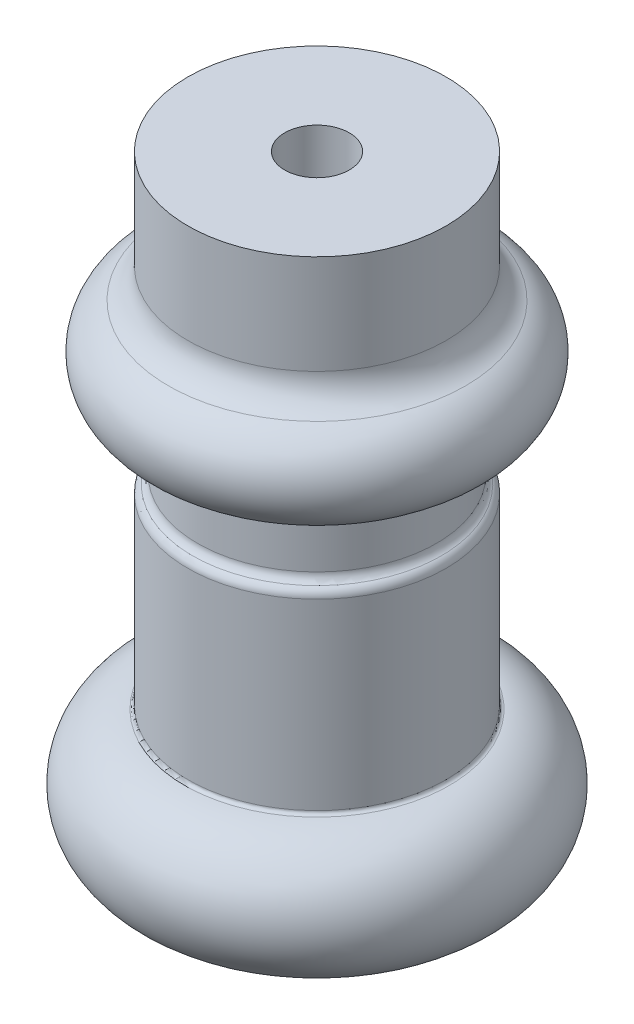
from build123d import *


with BuildPart() as part:
    # Sketch1 → Revolve2 (revolve)
    with BuildSketch(Plane.XY, mode=Mode.PRIVATE) as revolve2_sk:
        with BuildLine():
            Line((-12.047292047, 34.343974042), (-12.047292047, -90.656025958))
            Line((-12.047292047, -90.656025958), (35.140359276, -90.656025958))
            ThreePointArc((35.140359276, -90.656025958), (46.882736016, -69.11967468), (28.92917895, -52.405380602))
            ThreePointArc((28.92917895, -52.405380602), (28.233620187, -52.060910839), (27.952707953, -51.337343477))
            Line((27.952707953, -51.337343477), (27.952707953, 5.357218831))
            ThreePointArc((27.952707953, 5.357218831), (27.550784164, 6.857218831), (26.452707953, 7.955295042))
            ThreePointArc((26.452707953, 7.955295042), (25.354631742, 9.053371254), (24.952707953, 10.553371254))
            Line((24.952707953, 10.553371254), (24.952707953, 25.553371254))
            ThreePointArc((24.952707953, 25.553371254), (25.83138761, 27.674691597), (27.952707953, 28.553371254))
            ThreePointArc((27.952707953, 28.553371254), (42.636302647, 40.488726598), (33.952707953, 57.301098339))
            ThreePointArc((33.952707953, 57.301098339), (29.586107688, 60.989024154), (27.952707953, 66.466249729))
            Line((27.952707953, 66.466249729), (27.952707953, 97.211500144))
            Line((27.952707953, 97.211500144), (-2.047292047, 97.211500144))
            Line((-2.047292047, 97.211500144), (-2.047292047, 34.343974042))
            Line((-2.047292047, 34.343974042), (-12.047292047, 34.343974042))
        make_face()
    revolve(revolve2_sk.sketch.rotate(Axis((-12.047292047, -59.045233094, 0), (0, -1, 0)), 180), axis=Axis((-12.047292047, -59.045233094, 0), (0, -1, 0)))


solid = part.part
